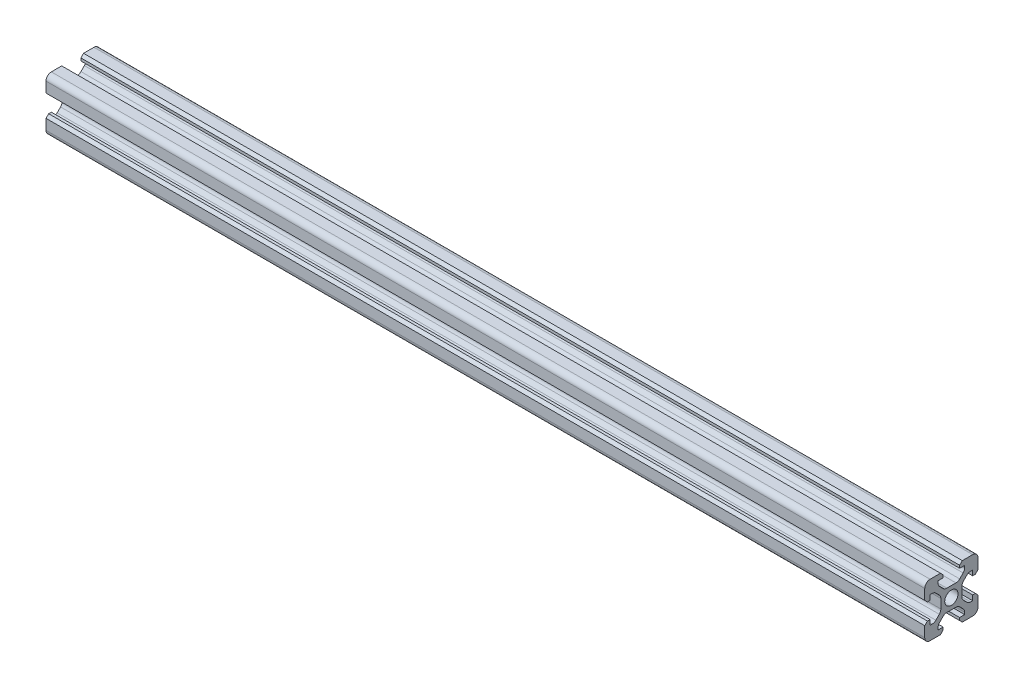
from build123d import *

# Parameters (mm, degrees)
SKETCH1_R           = 2.5
BOSS_EXTRUDE1_DEPTH = 330


with BuildPart() as part:
    # Sketch1 → Boss-Extrude1 (new body)
    with BuildSketch(Plane(origin=(0, 0, 0), x_dir=(0, 0, -1), z_dir=(1, 0, 0))):
        with BuildLine():
            Line((-4.1, 10), (-8, 10))
            ThreePointArc((-8, 10), (-9.414213562, 9.414213562), (-10, 8))
            Line((-10, 8), (-10, 4.1))
            Line((-10, 4.1), (-9, 3.1))
            Line((-9, 3.1), (-8, 3.1))
            Line((-8, 3.1), (-8, 5))
            Line((-8, 5), (-7.242640687, 5))
            ThreePointArc((-7.242640687, 5), (-6.477273822, 4.847759065), (-5.828427125, 4.414213562))
            Line((-5.828427125, 4.414213562), (-4.537854624, 3.123641061))
            ThreePointArc((-4.537854624, 3.123641061), (-4.104309121, 2.474794364), (-3.952068186, 1.709427499))
            Line((-3.952068186, 1.709427499), (-3.952068186, -1.709427499))
            ThreePointArc((-3.952068186, -1.709427499), (-4.104309121, -2.474794364), (-4.537854624, -3.123641061))
            Line((-4.537854624, -3.123641061), (-5.828427125, -4.414213562))
            ThreePointArc((-5.828427125, -4.414213562), (-6.477273822, -4.847759065), (-7.242640687, -5))
            Line((-7.242640687, -5), (-8, -5))
            Line((-8, -5), (-8, -3.1))
            Line((-8, -3.1), (-9, -3.1))
            Line((-9, -3.1), (-10, -4.1))
            Line((-10, -4.1), (-10, -8))
            ThreePointArc((-10, -8), (-9.414213562, -9.414213562), (-8, -10))
            Line((-8, -10), (-4.1, -10))
            Line((-4.1, -10), (-3.1, -9))
            Line((-3.1, -9), (-3.1, -8))
            Line((-3.1, -8), (-5, -8))
            Line((-5, -8), (-5, -7.242640687))
            ThreePointArc((-5, -7.242640687), (-4.847759065, -6.477273822), (-4.414213562, -5.828427125))
            Line((-4.414213562, -5.828427125), (-3.123641061, -4.537854624))
            ThreePointArc((-3.123641061, -4.537854624), (-2.474794364, -4.104309121), (-1.709427499, -3.952068186))
            Line((-1.709427499, -3.952068186), (1.709427499, -3.952068186))
            ThreePointArc((1.709427499, -3.952068186), (2.474794364, -4.104309121), (3.123641061, -4.537854624))
            Line((3.123641061, -4.537854624), (4.414213562, -5.828427125))
            ThreePointArc((4.414213562, -5.828427125), (4.847759065, -6.477273822), (5, -7.242640687))
            Line((5, -7.242640687), (5, -8))
            Line((5, -8), (3.1, -8))
            Line((3.1, -8), (3.1, -9))
            Line((3.1, -9), (4.1, -10))
            Line((4.1, -10), (8, -10))
            ThreePointArc((8, -10), (9.414213562, -9.414213562), (10, -8))
            Line((10, -8), (10, -4.1))
            Line((10, -4.1), (9, -3.1))
            Line((9, -3.1), (8, -3.1))
            Line((8, -3.1), (8, -5))
            Line((8, -5), (7.242640687, -5))
            ThreePointArc((7.242640687, -5), (6.477273822, -4.847759065), (5.828427125, -4.414213562))
            Line((5.828427125, -4.414213562), (4.537854624, -3.123641061))
            ThreePointArc((4.537854624, -3.123641061), (4.104309121, -2.474794364), (3.952068186, -1.709427499))
            Line((3.952068186, -1.709427499), (3.952068186, 1.709427499))
            ThreePointArc((3.952068186, 1.709427499), (4.104309121, 2.474794364), (4.537854624, 3.123641061))
            Line((4.537854624, 3.123641061), (5.828427125, 4.414213562))
            ThreePointArc((5.828427125, 4.414213562), (6.477273822, 4.847759065), (7.242640687, 5))
            Line((7.242640687, 5), (8, 5))
            Line((8, 5), (8, 3.1))
            Line((8, 3.1), (9, 3.1))
            Line((9, 3.1), (10, 4.1))
            Line((10, 4.1), (10, 8))
            ThreePointArc((10, 8), (9.414213562, 9.414213562), (8, 10))
            Line((8, 10), (4.1, 10))
            Line((4.1, 10), (3.1, 9))
            Line((3.1, 9), (3.1, 8))
            Line((3.1, 8), (5, 8))
            Line((5, 8), (5, 7.242640687))
            ThreePointArc((5, 7.242640687), (4.847759065, 6.477273822), (4.414213562, 5.828427125))
            Line((4.414213562, 5.828427125), (3.123641061, 4.537854624))
            ThreePointArc((3.123641061, 4.537854624), (2.474794364, 4.104309121), (1.709427499, 3.952068186))
            Line((1.709427499, 3.952068186), (-1.709427499, 3.952068186))
            ThreePointArc((-1.709427499, 3.952068186), (-2.474794364, 4.104309121), (-3.123641061, 4.537854624))
            Line((-3.123641061, 4.537854624), (-4.414213562, 5.828427125))
            ThreePointArc((-4.414213562, 5.828427125), (-4.847759065, 6.477273822), (-5, 7.242640687))
            Line((-5, 7.242640687), (-5, 8))
            Line((-5, 8), (-3.1, 8))
            Line((-3.1, 8), (-3.1, 9))
            Line((-3.1, 9), (-4.1, 10))
        make_face()
        Circle(SKETCH1_R, mode=Mode.SUBTRACT)
    extrude(amount=BOSS_EXTRUDE1_DEPTH)


solid = part.part
